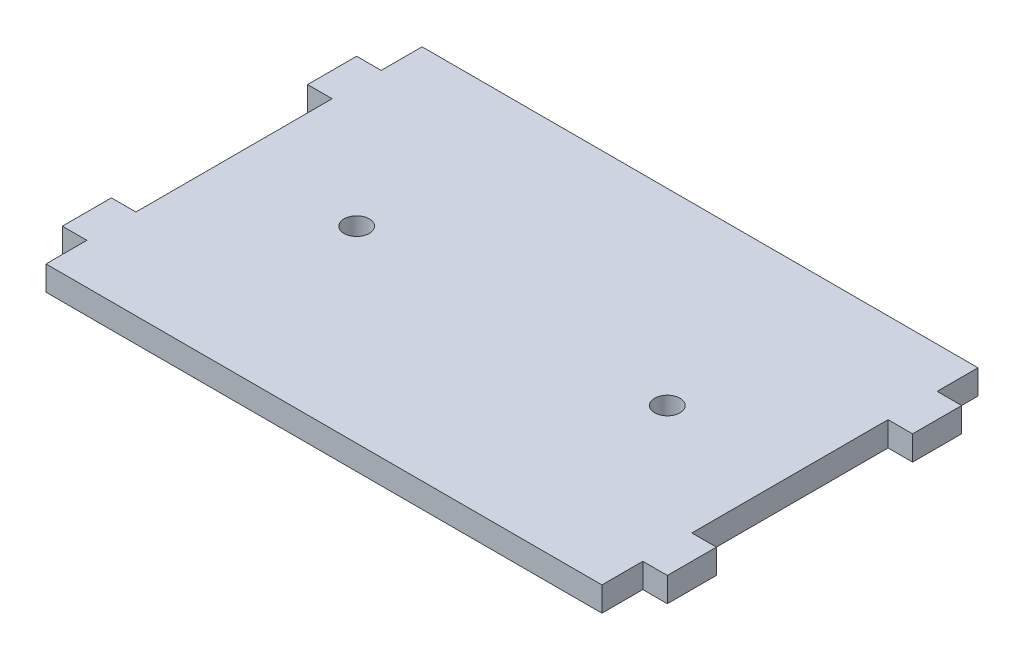
from build123d import *

# Parameters (mm, degrees)
SKETCH1_R           = 1.55
BOSS_EXTRUDE1_DEPTH = 3


with BuildPart() as part:
    # Sketch1 → Boss-Extrude1 (new body)
    with BuildSketch(Plane(origin=(0, 0, 0), x_dir=(1, 0, 0), z_dir=(0, 1, 0))):
        Polygon((-34, 23), (34, 23), (34, 18), (37, 18), (37, 12), (34, 12), (34, -12), (37, -12), (37, -18), (34, -18), (34, -23), (-34, -23), (-34, -18), (-37, -18), (-37, -12), (-34, -12), (-34, 12), (-37, 12), (-37, 18), (-34, 18), align=None)
        with Locations(Location((19, 0, 0), (0, 0, 270))):
            Circle(SKETCH1_R, mode=Mode.SUBTRACT)
        with Locations(Location((-19, 0, 0), (0, 0, 90))):
            Circle(SKETCH1_R, mode=Mode.SUBTRACT)
    extrude(amount=BOSS_EXTRUDE1_DEPTH)


solid = part.part
